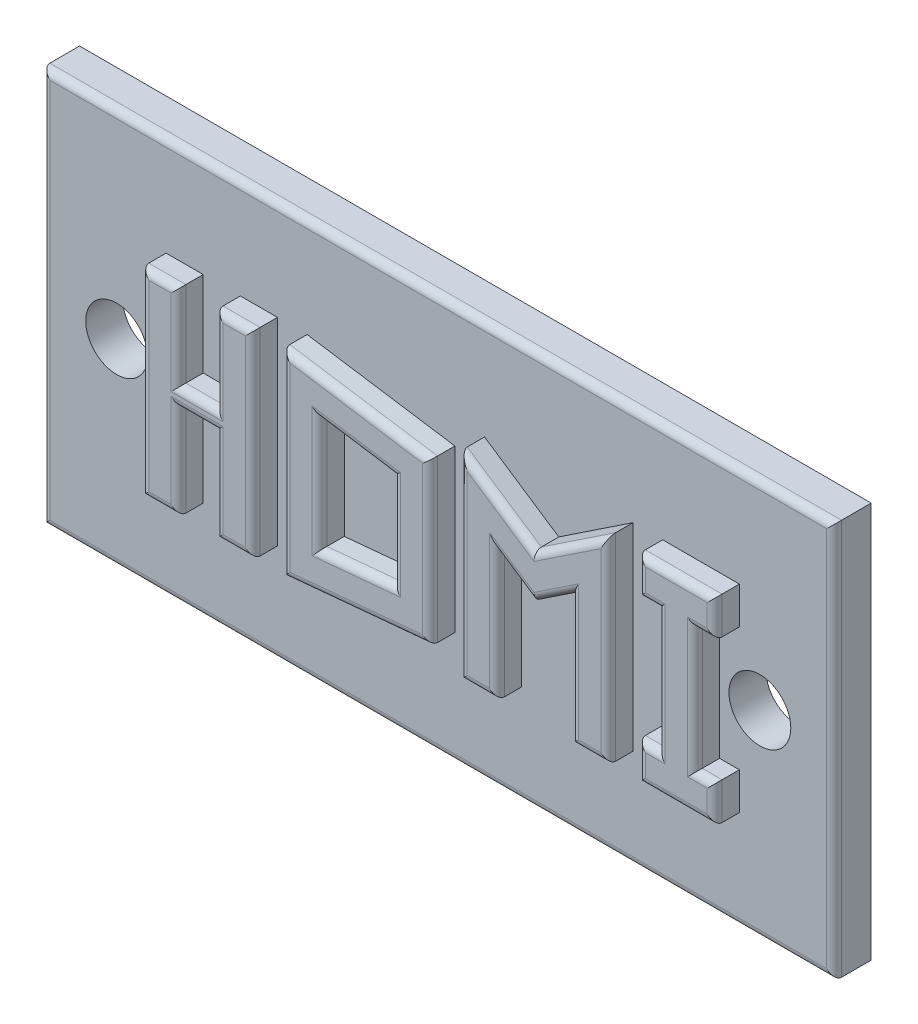
from build123d import *

# Parameters (mm, degrees)
SKETCH_1_W      = 32
SKETCH_1_H      = 16
SKETCH_1_R      = 1.25
EXTRUDE_1_DEPTH = 1.5
EXTRUDE_2_DEPTH = 1
FILLET_2_R      = 0.3


with BuildPart() as part:
    # Эскиз1 → Бобышка-Вытянуть1 (new body)
    with BuildSketch(Plane.XY):
        Rectangle(SKETCH_1_W, SKETCH_1_H)
        with Locations((-13, 0)):
            Circle(SKETCH_1_R, mode=Mode.SUBTRACT)
        with Locations((13, 0)):
            Circle(SKETCH_1_R, mode=Mode.SUBTRACT)
    extrude(amount=EXTRUDE_1_DEPTH)

    # Эскиз3 → Бобышка-Вытянуть2 (add)
    # profile 1 of 4: a face of its own
    with BuildSketch(Plane.XY.offset(1.5)):
        Polygon((-11, 4), (-11, -4), (-9.5, -4), (-9.5, -0.217121743), (-8, -0.217121743), (-8, -4), (-6.5, -4), (-6.5, 4), (-8, 4), (-8, 0.55188973), (-9.5, 0.55188973), (-9.5, 4), align=None)
    # profile 2 of 4: a face of its own
    with BuildSketch(Plane.XY.offset(1.5)):
        Polygon((-5.3, 4), (-5.3, -4), (0.67028136, -3.446242786), (0.67028136, 3.084011942), align=None)
        Polygon((-3.8, 2.252311448), (-3.8, -2.317138921), (-0.82971864, -2.041638549), (-0.82971864, 1.796597204), align=None, mode=Mode.SUBTRACT)
    # profile 3 of 4: a face of its own
    with BuildSketch(Plane.XY.offset(1.5)):
        Polygon((1.87028136, 4), (1.87028136, -4), (3.37028136, -4), (3.37028136, 1.197224362), (4.87028136, 0.197224362), (6.37028136, 1.197224362), (6.37028136, -4), (7.87028136, -4), (7.87028136, 4), (4.87028136, 2), align=None)
    # profile 4 of 4: a face of its own
    with BuildSketch(Plane.XY.offset(1.5)):
        Polygon((9.07028136, 4), (12.17028136, 4), (12.17028136, 2.5), (11.37028136, 2.5), (11.37028136, -2.5), (12.17028136, -2.5), (12.17028136, -4), (9.07028136, -4), (9.07028136, -2.5), (9.87028136, -2.5), (9.87028136, 2.5), (9.07028136, 2.5), align=None)
    extrude(amount=EXTRUDE_2_DEPTH)

    # Скругление2
    fillet_2_edges = [part.edges().sort_by_distance(p)[0] for p in [
        (16, 0, 1.5),
        (9.07028136, 3.25, 2.5),
        (9.47028136, 2.5, 2.5),
        (9.87028136, 0, 2.5),
        (9.47028136, -2.5, 2.5),
        (9.07028136, -3.25, 2.5),
        (10.62028136, -4, 2.5),
        (12.17028136, -3.25, 2.5),
        (11.77028136, -2.5, 2.5),
        (11.37028136, 0, 2.5),
        (11.77028136, 2.5, 2.5),
        (12.17028136, 3.25, 2.5),
        (10.62028136, 4, 2.5),
        (0, 8, 1.5),
        (-10.25, 4, 2.5),
        (-11, 0, 2.5),
        (-10.25, -4, 2.5),
        (-9.5, -2.108560871, 2.5),
        (-8.75, -0.217121743, 2.5),
        (-8, -2.108560871, 2.5),
        (-7.25, -4, 2.5),
        (-6.5, 0, 2.5),
        (-7.25, 4, 2.5),
        (-8, 2.275944865, 2.5),
        (-8.75, 0.55188973, 2.5),
        (-9.5, 2.275944865, 2.5),
        (-16, 0, 1.5),
        (-2.31485932, 3.542005971, 2.5),
        (-5.3, 0, 2.5),
        (-2.31485932, -3.723121393, 2.5),
        (0.67028136, -0.181115422, 2.5),
        (-2.31485932, 2.024454326, 2.5),
        (-3.8, -0.032413737, 2.5),
        (-2.31485932, -2.179388735, 2.5),
        (-0.82971864, -0.122520673, 2.5),
        (0, -8, 1.5),
        (2.62028136, -4, 2.5),
        (3.37028136, -1.401387819, 2.5),
        (4.12028136, 0.697224362, 2.5),
        (5.62028136, 0.697224362, 2.5),
        (6.37028136, -1.401387819, 2.5),
        (7.12028136, -4, 2.5),
        (7.87028136, 0, 2.5),
        (6.37028136, 3, 2.5),
        (3.37028136, 3, 2.5),
        (1.87028136, 0, 2.5),
    ]]
    fillet(fillet_2_edges, radius=FILLET_2_R)


solid = part.part
